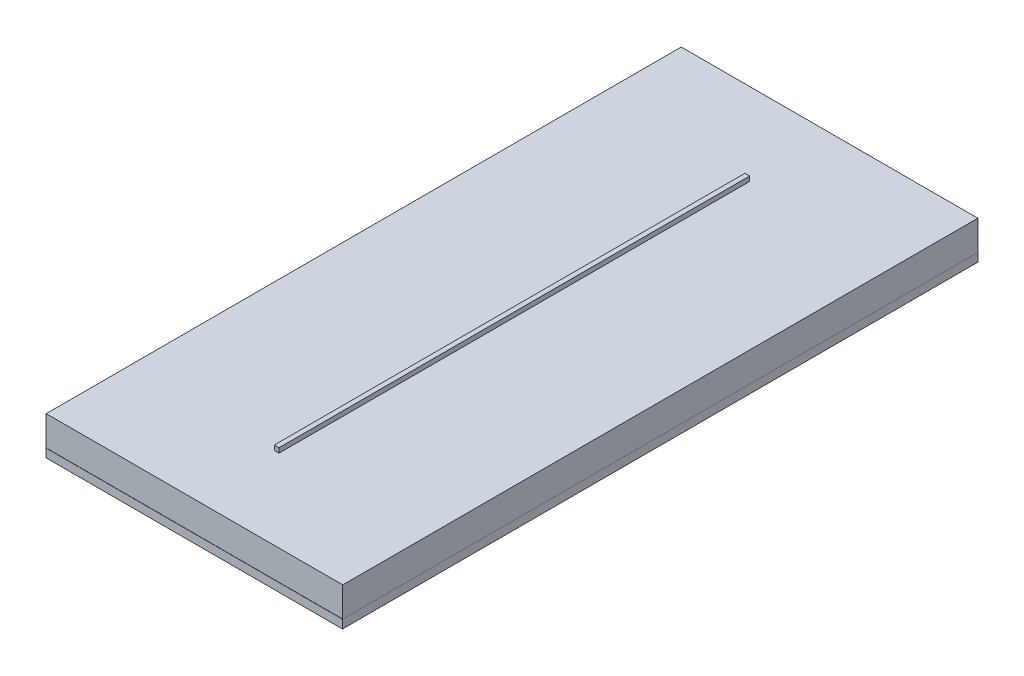
from build123d import *

# Parameters (mm, degrees)
SKETCH1_W           = 69.99
SKETCH1_H           = 150
BOSS_EXTRUDE1_DEPTH = 2
SKETCH2_W           = 70
SKETCH2_H           = 149.9
BOSS_EXTRUDE3_DEPTH = 7
SCALE1_SCALE        = 5
SCALE2_SCALE        = 0.9
SCALE3_SCALE        = 0.1
SKETCH3_W           = 0.5
SKETCH3_H           = 50
BOSS_EXTRUDE4_DEPTH = 0.5


with BuildPart() as part:
    # Sketch1 → Boss-Extrude1 (new body)
    with BuildSketch(Plane(origin=(0, 0, 0), x_dir=(1, 0, 0), z_dir=(0, 1, 0))):
        Rectangle(SKETCH1_W, SKETCH1_H)
    extrude(amount=BOSS_EXTRUDE1_DEPTH)

    # Sketch2 → Boss-Extrude3 (add)
    with BuildSketch(Plane(origin=(0, 2, 0), x_dir=(1, 0, 0), z_dir=(0, 1, 0))):
        Rectangle(SKETCH2_W, SKETCH2_H)
    extrude(amount=BOSS_EXTRUDE3_DEPTH)


with BuildPart() as part_1:
    # Scale1: scaled about (0, 4.499592368, 0)
    add(part.part.scale(SCALE1_SCALE).moved(Location((0, -17.998369472, 0))))


with BuildPart() as part_2:
    # Scale2: scaled about (0, 4.499592369, 0)
    add(part_1.part.scale(SCALE2_SCALE).moved(Location((0, 0.449959237, 0))))


with BuildPart() as part_3:
    # Scale3: scaled about (0, 4.499592369, 0)
    add(part_2.part.scale(SCALE3_SCALE).moved(Location((0, 4.049633132, 0))))

    # Sketch3 → Boss-Extrude4 (add)
    with BuildSketch(Plane(origin=(0, 6.524775803, 0), x_dir=(1, 0, 0), z_dir=(0, 1, 0))):
        Rectangle(SKETCH3_W, SKETCH3_H)
    extrude(amount=BOSS_EXTRUDE4_DEPTH)


solid = part_3.part
